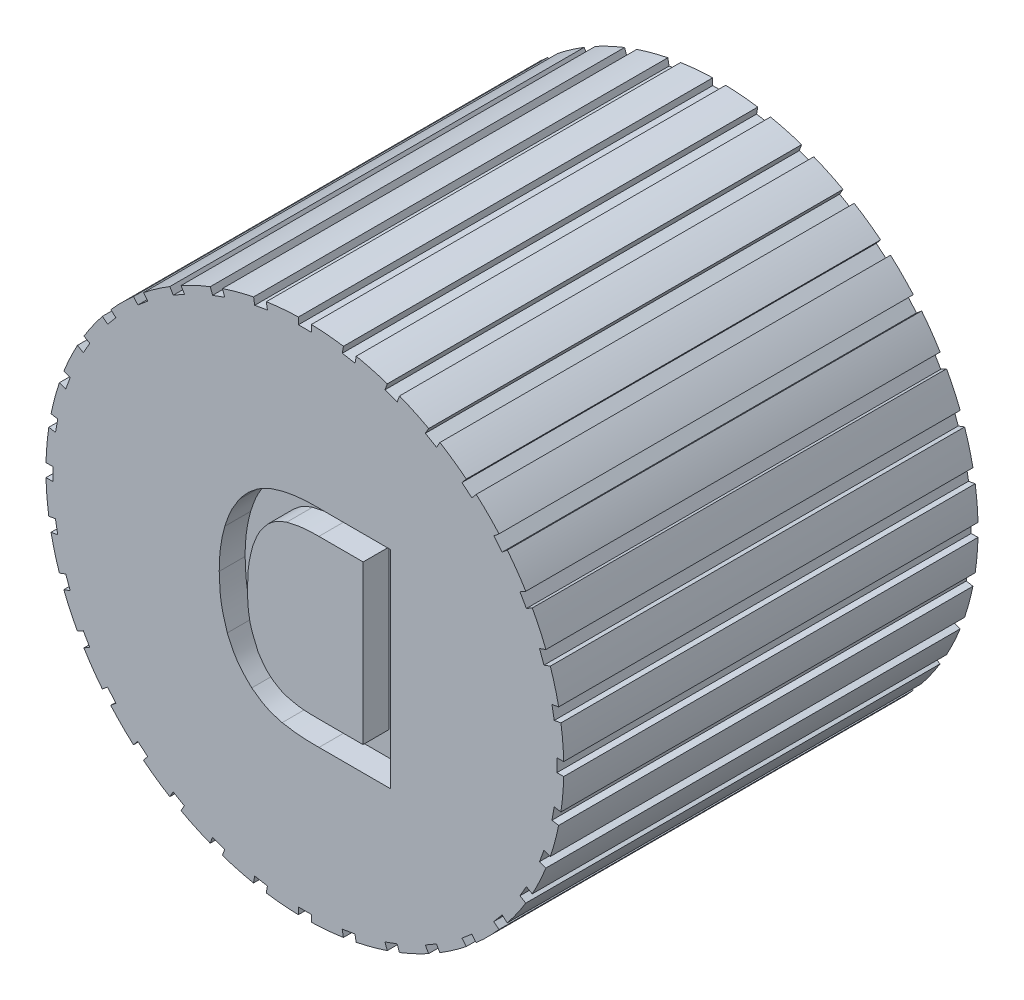
from build123d import *

# Parameters (mm, degrees)
SKETCH1_W                    = 10.000000149
SKETCH1_H                    = 16
CUT_EXTRUDE1_DEPTH           = 16
CUT_EXTRUDE2_DEPTH           = 16
CUT_EXTRUDE3_DEPTH           = 16
CUT_EXTRUDE4_DEPTH           = 16
CUT_EXTRUDE5_DEPTH           = 16
CUT_EXTRUDE6_DEPTH           = 16
CUT_EXTRUDE7_DEPTH           = 16
CUT_EXTRUDE8_DEPTH           = 16
CUT_EXTRUDE9_DEPTH           = 16
CUT_EXTRUDE10_DEPTH          = 16
CUT_EXTRUDE11_DEPTH          = 16
CUT_EXTRUDE12_DEPTH          = 16
CUT_EXTRUDE13_DEPTH          = 16
CUT_EXTRUDE14_DEPTH          = 16
CUT_EXTRUDE15_DEPTH          = 16
CUT_EXTRUDE16_DEPTH          = 16
CUT_EXTRUDE17_DEPTH          = 16
CUT_EXTRUDE18_DEPTH          = 16
CUT_EXTRUDE19_DEPTH          = 16
CUT_EXTRUDE20_DEPTH          = 16
CUT_EXTRUDE21_DEPTH          = 16
CUT_EXTRUDE22_DEPTH          = 16
CUT_EXTRUDE23_DEPTH          = 16
CUT_EXTRUDE24_DEPTH          = 16
CUT_EXTRUDE25_DEPTH          = 16
CUT_EXTRUDE26_DEPTH          = 16
CUT_EXTRUDE27_DEPTH          = 16
CUT_EXTRUDE28_DEPTH          = 16
CUT_EXTRUDE29_DEPTH          = 16
CUT_EXTRUDE30_DEPTH          = 16
CUT_EXTRUDE31_DEPTH          = 16
CUT_EXTRUDE32_DEPTH          = 16
CUT_EXTRUDE33_DEPTH          = 16
CUT_EXTRUDE34_DEPTH          = 16
CUT_EXTRUDE35_DEPTH          = 16
CUT_EXTRUDE36_DEPTH          = 16
CUT_EXTRUDE37_START          = 3
CUT_EXTRUDE37_DEPTH          = 1
BOSS_EXTRUDE1_START          = 3.000001
BOSS_EXTRUDE1_DEPTH          = 1
F_6_0_6_DIAMETER_HOLE1_D     = 6
F_6_0_6_DIAMETER_HOLE1_DEPTH = 14


with BuildPart() as part:
    # Sketch1 → Revolve1 (revolve)
    with BuildSketch(Plane(origin=(0, 0, 0), x_dir=(1, 0, 0), z_dir=(0, 1, 0))):
        with Locations((5.000000074, -8)):
            Rectangle(SKETCH1_W, SKETCH1_H)
    revolve(axis=Axis((0, 0, 0), (0, 0, 1)))

    # Sketch2 → Cut-Extrude1 (cut)
    with BuildSketch(Plane(origin=(0, 0, 0), x_dir=(-1, 0, 0), z_dir=(0, 0, -1))):
        with BuildLine():
            Line((3.182999705, 9.479900625), (3.093633551, 9.234369134))
            Line((3.093633551, 9.234369134), (3.563197034, 9.063462003))
            Line((3.563197034, 9.063462003), (3.65258757, 9.30906048))
            ThreePointArc((3.65258757, 9.30906048), (3.418860912, 9.397414168), (3.182999705, 9.479900625))
        make_face()
    extrude(amount=-CUT_EXTRUDE1_DEPTH, mode=Mode.SUBTRACT)

    # Sketch3 → Cut-Extrude2 (cut)
    with BuildSketch(Plane(origin=(0, 0, 0), x_dir=(-1, 0, 0), z_dir=(0, 0, -1))):
        with BuildLine():
            Line((4.780810256, 8.783157535), (4.650165678, 8.556874488))
            Line((4.650165678, 8.556874488), (5.082917725, 8.307024978))
            Line((5.082917725, 8.307024978), (5.213597945, 8.533369759))
            ThreePointArc((5.213597945, 8.533369759), (4.998764578, 8.660967364), (4.780810256, 8.783157535))
        make_face()
    extrude(amount=-CUT_EXTRUDE2_DEPTH, mode=Mode.SUBTRACT)

    # Sketch4 → Cut-Extrude3 (cut)
    with BuildSketch(Plane(origin=(0, 0, 0), x_dir=(-1, 0, 0), z_dir=(0, 0, -1))):
        with BuildLine():
            Line((6.233358306, 7.819542647), (6.065404874, 7.619383542))
            Line((6.065404874, 7.619383542), (6.448196533, 7.298183202))
            Line((6.448196533, 7.298183202), (6.616195786, 7.498396916))
            ThreePointArc((6.616195786, 7.498396916), (6.426783311, 7.661361449), (6.233358306, 7.819542647))
        make_face()
    extrude(amount=-CUT_EXTRUDE3_DEPTH, mode=Mode.SUBTRACT)

    # Sketch5 → Cut-Extrude4 (cut)
    with BuildSketch(Plane(origin=(0, 0, 0), x_dir=(-1, 0, 0), z_dir=(0, 0, -1))):
        with BuildLine():
            Line((7.496508918, 6.618334914), (7.296349812, 6.450381482))
            Line((7.296349812, 6.450381482), (7.617550152, 6.067589824))
            Line((7.617550152, 6.067589824), (7.817763865, 6.235589077))
            ThreePointArc((7.817763865, 6.235589077), (7.659527486, 6.428968943), (7.496508918, 6.618334914))
        make_face()
    extrude(amount=-CUT_EXTRUDE4_DEPTH, mode=Mode.SUBTRACT)

    # Sketch6 → Cut-Extrude5 (cut)
    with BuildSketch(Plane(origin=(0, 0, 0), x_dir=(-1, 0, 0), z_dir=(0, 0, -1))):
        with BuildLine():
            Line((8.531881899, 5.216032423), (8.305598853, 5.085387845))
            Line((8.305598853, 5.085387845), (8.555448364, 4.652635798))
            Line((8.555448364, 4.652635798), (8.781793145, 4.783316019))
            ThreePointArc((8.781793145, 4.783316019), (8.659540794, 5.001235469), (8.531881899, 5.216032423))
        make_face()
    extrude(amount=-CUT_EXTRUDE5_DEPTH, mode=Mode.SUBTRACT)

    # Sketch7 → Cut-Extrude6 (cut)
    with BuildSketch(Plane(origin=(0, 0, 0), x_dir=(-1, 0, 0), z_dir=(0, 0, -1))):
        with BuildLine():
            Line((9.308017967, 3.655243426), (9.062486476, 3.565877272))
            Line((9.062486476, 3.565877272), (9.233393607, 3.096313789))
            Line((9.233393607, 3.096313789), (9.478992085, 3.185704324))
            ThreePointArc((9.478992085, 3.185704324), (9.396438337, 3.421541987), (9.308017967, 3.655243426))
        make_face()
    extrude(amount=-CUT_EXTRUDE6_DEPTH, mode=Mode.SUBTRACT)

    # Sketch8 → Cut-Extrude7 (cut)
    with BuildSketch(Plane(origin=(0, 0, 0), x_dir=(-1, 0, 0), z_dir=(0, 0, -1))):
        with BuildLine():
            Line((9.801334619, 1.983391707), (9.544015033, 1.938019322))
            Line((9.544015033, 1.938019322), (9.630786858, 1.445911851))
            Line((9.630786858, 1.445911851), (9.888176646, 1.491296615))
            ThreePointArc((9.888176646, 1.491296615), (9.847829855, 1.737886682), (9.801334619, 1.983391707))
        make_face()
    extrude(amount=-CUT_EXTRUDE7_DEPTH, mode=Mode.SUBTRACT)

    # Sketch9 → Cut-Extrude8 (cut)
    with BuildSketch(Plane(origin=(0, 0, 0), x_dir=(-1, 0, 0), z_dir=(0, 0, -1))):
        with BuildLine():
            Line((9.996842678, 0.251275635), (9.735553523, 0.251275635))
            Line((9.735553523, 0.251275635), (9.735553523, -0.248423386))
            Line((9.735553523, -0.248423386), (9.996913964, -0.248423386))
            ThreePointArc((9.996913964, -0.248423386), (10.000000047, 0.00142657), (9.996842678, 0.251275635))
        make_face()
    extrude(amount=-CUT_EXTRUDE8_DEPTH, mode=Mode.SUBTRACT)

    # Sketch10 → Cut-Extrude9 (cut)
    with BuildSketch(Plane(origin=(0, 0, 0), x_dir=(-1, 0, 0), z_dir=(0, 0, -1))):
        with BuildLine():
            Line((9.888601731, -1.48847532), (9.631282146, -1.443102934))
            Line((9.631282146, -1.443102934), (9.544510321, -1.935210405))
            Line((9.544510321, -1.935210405), (9.80190011, -1.980595169))
            ThreePointArc((9.80190011, -1.980595169), (9.848325298, -1.735076888), (9.888601731, -1.48847532))
        make_face()
    extrude(amount=-CUT_EXTRUDE9_DEPTH, mode=Mode.SUBTRACT)

    # Sketch11 → Cut-Extrude10 (cut)
    with BuildSketch(Plane(origin=(0, 0, 0), x_dir=(-1, 0, 0), z_dir=(0, 0, -1))):
        with BuildLine():
            Line((9.479900625, -3.182999705), (9.234369134, -3.093633551))
            Line((9.234369134, -3.093633551), (9.063462003, -3.563197034))
            Line((9.063462003, -3.563197034), (9.30906048, -3.65258757))
            ThreePointArc((9.30906048, -3.65258757), (9.397414168, -3.418860912), (9.479900625, -3.182999705))
        make_face()
    extrude(amount=-CUT_EXTRUDE10_DEPTH, mode=Mode.SUBTRACT)

    # Sketch12 → Cut-Extrude11 (cut)
    with BuildSketch(Plane(origin=(0, 0, 0), x_dir=(-1, 0, 0), z_dir=(0, 0, -1))):
        with BuildLine():
            Line((8.783157535, -4.780810256), (8.556874488, -4.650165678))
            Line((8.556874488, -4.650165678), (8.307024978, -5.082917725))
            Line((8.307024978, -5.082917725), (8.533369759, -5.213597945))
            ThreePointArc((8.533369759, -5.213597945), (8.660967364, -4.998764578), (8.783157535, -4.780810256))
        make_face()
    extrude(amount=-CUT_EXTRUDE11_DEPTH, mode=Mode.SUBTRACT)

    # Sketch13 → Cut-Extrude12 (cut)
    with BuildSketch(Plane(origin=(0, 0, 0), x_dir=(-1, 0, 0), z_dir=(0, 0, -1))):
        with BuildLine():
            Line((7.819542647, -6.233358306), (7.619383542, -6.065404874))
            Line((7.619383542, -6.065404874), (7.298183202, -6.448196533))
            Line((7.298183202, -6.448196533), (7.498396916, -6.616195786))
            ThreePointArc((7.498396916, -6.616195786), (7.661361449, -6.426783311), (7.819542647, -6.233358306))
        make_face()
    extrude(amount=-CUT_EXTRUDE12_DEPTH, mode=Mode.SUBTRACT)

    # Sketch14 → Cut-Extrude13 (cut)
    with BuildSketch(Plane(origin=(0, 0, 0), x_dir=(-1, 0, 0), z_dir=(0, 0, -1))):
        with BuildLine():
            Line((6.618334914, -7.496508918), (6.450381482, -7.296349812))
            Line((6.450381482, -7.296349812), (6.067589824, -7.617550152))
            Line((6.067589824, -7.617550152), (6.235589077, -7.817763865))
            ThreePointArc((6.235589077, -7.817763865), (6.428968943, -7.659527486), (6.618334914, -7.496508918))
        make_face()
    extrude(amount=-CUT_EXTRUDE13_DEPTH, mode=Mode.SUBTRACT)

    # Sketch15 → Cut-Extrude14 (cut)
    with BuildSketch(Plane(origin=(0, 0, 0), x_dir=(-1, 0, 0), z_dir=(0, 0, -1))):
        with BuildLine():
            Line((5.216032423, -8.531881899), (5.085387845, -8.305598853))
            Line((5.085387845, -8.305598853), (4.652635798, -8.555448364))
            Line((4.652635798, -8.555448364), (4.783316019, -8.781793145))
            ThreePointArc((4.783316019, -8.781793145), (5.001235469, -8.659540794), (5.216032423, -8.531881899))
        make_face()
    extrude(amount=-CUT_EXTRUDE14_DEPTH, mode=Mode.SUBTRACT)

    # Sketch16 → Cut-Extrude15 (cut)
    with BuildSketch(Plane(origin=(0, 0, 0), x_dir=(-1, 0, 0), z_dir=(0, 0, -1))):
        with BuildLine():
            Line((3.655243426, -9.308017967), (3.565877272, -9.062486476))
            Line((3.565877272, -9.062486476), (3.096313789, -9.233393607))
            Line((3.096313789, -9.233393607), (3.185704324, -9.478992085))
            ThreePointArc((3.185704324, -9.478992085), (3.421541987, -9.396438337), (3.655243426, -9.308017967))
        make_face()
    extrude(amount=-CUT_EXTRUDE15_DEPTH, mode=Mode.SUBTRACT)

    # Sketch17 → Cut-Extrude16 (cut)
    with BuildSketch(Plane(origin=(0, 0, 0), x_dir=(-1, 0, 0), z_dir=(0, 0, -1))):
        with BuildLine():
            Line((1.983391707, -9.801334619), (1.938019322, -9.544015033))
            Line((1.938019322, -9.544015033), (1.445911851, -9.630786858))
            Line((1.445911851, -9.630786858), (1.491296615, -9.888176646))
            ThreePointArc((1.491296615, -9.888176646), (1.737886682, -9.847829855), (1.983391707, -9.801334619))
        make_face()
    extrude(amount=-CUT_EXTRUDE16_DEPTH, mode=Mode.SUBTRACT)

    # Sketch18 → Cut-Extrude17 (cut)
    with BuildSketch(Plane(origin=(0, 0, 0), x_dir=(-1, 0, 0), z_dir=(0, 0, -1))):
        with BuildLine():
            Line((0.251275635, -9.996842678), (0.251275635, -9.735553523))
            Line((0.251275635, -9.735553523), (-0.248423386, -9.735553523))
            Line((-0.248423386, -9.735553523), (-0.248423386, -9.996913964))
            ThreePointArc((-0.248423386, -9.996913964), (0.00142657, -10.000000047), (0.251275635, -9.996842678))
        make_face()
    extrude(amount=-CUT_EXTRUDE17_DEPTH, mode=Mode.SUBTRACT)

    # Sketch19 → Cut-Extrude18 (cut)
    with BuildSketch(Plane(origin=(0, 0, 0), x_dir=(-1, 0, 0), z_dir=(0, 0, -1))):
        with BuildLine():
            Line((-1.48847532, -9.888601731), (-1.443102934, -9.631282146))
            Line((-1.443102934, -9.631282146), (-1.935210405, -9.544510321))
            Line((-1.935210405, -9.544510321), (-1.980595169, -9.80190011))
            ThreePointArc((-1.980595169, -9.80190011), (-1.735076888, -9.848325298), (-1.48847532, -9.888601731))
        make_face()
    extrude(amount=-CUT_EXTRUDE18_DEPTH, mode=Mode.SUBTRACT)

    # Sketch20 → Cut-Extrude19 (cut)
    with BuildSketch(Plane(origin=(0, 0, 0), x_dir=(-1, 0, 0), z_dir=(0, 0, -1))):
        with BuildLine():
            Line((-3.182999705, -9.479900625), (-3.093633551, -9.234369134))
            Line((-3.093633551, -9.234369134), (-3.563197034, -9.063462003))
            Line((-3.563197034, -9.063462003), (-3.65258757, -9.30906048))
            ThreePointArc((-3.65258757, -9.30906048), (-3.418860912, -9.397414168), (-3.182999705, -9.479900625))
        make_face()
    extrude(amount=-CUT_EXTRUDE19_DEPTH, mode=Mode.SUBTRACT)

    # Sketch21 → Cut-Extrude20 (cut)
    with BuildSketch(Plane(origin=(0, 0, 0), x_dir=(-1, 0, 0), z_dir=(0, 0, -1))):
        with BuildLine():
            Line((-4.780810256, -8.783157535), (-4.650165678, -8.556874488))
            Line((-4.650165678, -8.556874488), (-5.082917725, -8.307024978))
            Line((-5.082917725, -8.307024978), (-5.213597945, -8.533369759))
            ThreePointArc((-5.213597945, -8.533369759), (-4.998764578, -8.660967364), (-4.780810256, -8.783157535))
        make_face()
    extrude(amount=-CUT_EXTRUDE20_DEPTH, mode=Mode.SUBTRACT)

    # Sketch22 → Cut-Extrude21 (cut)
    with BuildSketch(Plane(origin=(0, 0, 0), x_dir=(-1, 0, 0), z_dir=(0, 0, -1))):
        with BuildLine():
            Line((-6.233358306, -7.819542647), (-6.065404874, -7.619383542))
            Line((-6.065404874, -7.619383542), (-6.448196533, -7.298183202))
            Line((-6.448196533, -7.298183202), (-6.616195786, -7.498396916))
            ThreePointArc((-6.616195786, -7.498396916), (-6.426783311, -7.661361449), (-6.233358306, -7.819542647))
        make_face()
    extrude(amount=-CUT_EXTRUDE21_DEPTH, mode=Mode.SUBTRACT)

    # Sketch23 → Cut-Extrude22 (cut)
    with BuildSketch(Plane(origin=(0, 0, 0), x_dir=(-1, 0, 0), z_dir=(0, 0, -1))):
        with BuildLine():
            Line((-7.496508918, -6.618334914), (-7.296349812, -6.450381482))
            Line((-7.296349812, -6.450381482), (-7.617550152, -6.067589824))
            Line((-7.617550152, -6.067589824), (-7.817763865, -6.235589077))
            ThreePointArc((-7.817763865, -6.235589077), (-7.659527486, -6.428968943), (-7.496508918, -6.618334914))
        make_face()
    extrude(amount=-CUT_EXTRUDE22_DEPTH, mode=Mode.SUBTRACT)

    # Sketch24 → Cut-Extrude23 (cut)
    with BuildSketch(Plane(origin=(0, 0, 0), x_dir=(-1, 0, 0), z_dir=(0, 0, -1))):
        with BuildLine():
            Line((-8.531881899, -5.216032423), (-8.305598853, -5.085387845))
            Line((-8.305598853, -5.085387845), (-8.555448364, -4.652635798))
            Line((-8.555448364, -4.652635798), (-8.781793145, -4.783316019))
            ThreePointArc((-8.781793145, -4.783316019), (-8.659540794, -5.001235469), (-8.531881899, -5.216032423))
        make_face()
    extrude(amount=-CUT_EXTRUDE23_DEPTH, mode=Mode.SUBTRACT)

    # Sketch25 → Cut-Extrude24 (cut)
    with BuildSketch(Plane(origin=(0, 0, 0), x_dir=(-1, 0, 0), z_dir=(0, 0, -1))):
        with BuildLine():
            Line((-9.308017967, -3.655243426), (-9.062486476, -3.565877272))
            Line((-9.062486476, -3.565877272), (-9.233393607, -3.096313789))
            Line((-9.233393607, -3.096313789), (-9.478992085, -3.185704324))
            ThreePointArc((-9.478992085, -3.185704324), (-9.396438337, -3.421541987), (-9.308017967, -3.655243426))
        make_face()
    extrude(amount=-CUT_EXTRUDE24_DEPTH, mode=Mode.SUBTRACT)

    # Sketch26 → Cut-Extrude25 (cut)
    with BuildSketch(Plane(origin=(0, 0, 0), x_dir=(-1, 0, 0), z_dir=(0, 0, -1))):
        with BuildLine():
            Line((-9.801334619, -1.983391707), (-9.544015033, -1.938019322))
            Line((-9.544015033, -1.938019322), (-9.630786858, -1.445911851))
            Line((-9.630786858, -1.445911851), (-9.888176646, -1.491296615))
            ThreePointArc((-9.888176646, -1.491296615), (-9.847829855, -1.737886682), (-9.801334619, -1.983391707))
        make_face()
    extrude(amount=-CUT_EXTRUDE25_DEPTH, mode=Mode.SUBTRACT)

    # Sketch27 → Cut-Extrude26 (cut)
    with BuildSketch(Plane(origin=(0, 0, 0), x_dir=(-1, 0, 0), z_dir=(0, 0, -1))):
        with BuildLine():
            Line((-9.996842678, -0.251275635), (-9.735553523, -0.251275635))
            Line((-9.735553523, -0.251275635), (-9.735553523, 0.248423386))
            Line((-9.735553523, 0.248423386), (-9.996913964, 0.248423386))
            ThreePointArc((-9.996913964, 0.248423386), (-10.000000047, -0.00142657), (-9.996842678, -0.251275635))
        make_face()
    extrude(amount=-CUT_EXTRUDE26_DEPTH, mode=Mode.SUBTRACT)

    # Sketch28 → Cut-Extrude27 (cut)
    with BuildSketch(Plane(origin=(0, 0, 0), x_dir=(-1, 0, 0), z_dir=(0, 0, -1))):
        with BuildLine():
            Line((-9.888601731, 1.48847532), (-9.631282146, 1.443102934))
            Line((-9.631282146, 1.443102934), (-9.544510321, 1.935210405))
            Line((-9.544510321, 1.935210405), (-9.80190011, 1.980595169))
            ThreePointArc((-9.80190011, 1.980595169), (-9.848325298, 1.735076888), (-9.888601731, 1.48847532))
        make_face()
    extrude(amount=-CUT_EXTRUDE27_DEPTH, mode=Mode.SUBTRACT)

    # Sketch29 → Cut-Extrude28 (cut)
    with BuildSketch(Plane(origin=(0, 0, 0), x_dir=(-1, 0, 0), z_dir=(0, 0, -1))):
        with BuildLine():
            Line((-9.479900625, 3.182999705), (-9.234369134, 3.093633551))
            Line((-9.234369134, 3.093633551), (-9.063462003, 3.563197034))
            Line((-9.063462003, 3.563197034), (-9.30906048, 3.65258757))
            ThreePointArc((-9.30906048, 3.65258757), (-9.397414168, 3.418860912), (-9.479900625, 3.182999705))
        make_face()
    extrude(amount=-CUT_EXTRUDE28_DEPTH, mode=Mode.SUBTRACT)

    # Sketch30 → Cut-Extrude29 (cut)
    with BuildSketch(Plane(origin=(0, 0, 0), x_dir=(-1, 0, 0), z_dir=(0, 0, -1))):
        with BuildLine():
            Line((-8.783157535, 4.780810256), (-8.556874488, 4.650165678))
            Line((-8.556874488, 4.650165678), (-8.307024978, 5.082917725))
            Line((-8.307024978, 5.082917725), (-8.533369759, 5.213597945))
            ThreePointArc((-8.533369759, 5.213597945), (-8.660967364, 4.998764578), (-8.783157535, 4.780810256))
        make_face()
    extrude(amount=-CUT_EXTRUDE29_DEPTH, mode=Mode.SUBTRACT)

    # Sketch31 → Cut-Extrude30 (cut)
    with BuildSketch(Plane(origin=(0, 0, 0), x_dir=(-1, 0, 0), z_dir=(0, 0, -1))):
        with BuildLine():
            Line((-7.819542647, 6.233358306), (-7.619383542, 6.065404874))
            Line((-7.619383542, 6.065404874), (-7.298183202, 6.448196533))
            Line((-7.298183202, 6.448196533), (-7.498396916, 6.616195786))
            ThreePointArc((-7.498396916, 6.616195786), (-7.661361449, 6.426783311), (-7.819542647, 6.233358306))
        make_face()
    extrude(amount=-CUT_EXTRUDE30_DEPTH, mode=Mode.SUBTRACT)

    # Sketch32 → Cut-Extrude31 (cut)
    with BuildSketch(Plane(origin=(0, 0, 0), x_dir=(-1, 0, 0), z_dir=(0, 0, -1))):
        with BuildLine():
            Line((-6.618334914, 7.496508918), (-6.450381482, 7.296349812))
            Line((-6.450381482, 7.296349812), (-6.067589824, 7.617550152))
            Line((-6.067589824, 7.617550152), (-6.235589077, 7.817763865))
            ThreePointArc((-6.235589077, 7.817763865), (-6.428968943, 7.659527486), (-6.618334914, 7.496508918))
        make_face()
    extrude(amount=-CUT_EXTRUDE31_DEPTH, mode=Mode.SUBTRACT)

    # Sketch33 → Cut-Extrude32 (cut)
    with BuildSketch(Plane(origin=(0, 0, 0), x_dir=(-1, 0, 0), z_dir=(0, 0, -1))):
        with BuildLine():
            Line((-5.216032423, 8.531881899), (-5.085387845, 8.305598853))
            Line((-5.085387845, 8.305598853), (-4.652635798, 8.555448364))
            Line((-4.652635798, 8.555448364), (-4.783316019, 8.781793145))
            ThreePointArc((-4.783316019, 8.781793145), (-5.001235469, 8.659540794), (-5.216032423, 8.531881899))
        make_face()
    extrude(amount=-CUT_EXTRUDE32_DEPTH, mode=Mode.SUBTRACT)

    # Sketch34 → Cut-Extrude33 (cut)
    with BuildSketch(Plane(origin=(0, 0, 0), x_dir=(-1, 0, 0), z_dir=(0, 0, -1))):
        with BuildLine():
            Line((-3.655243426, 9.308017967), (-3.565877272, 9.062486476))
            Line((-3.565877272, 9.062486476), (-3.096313789, 9.233393607))
            Line((-3.096313789, 9.233393607), (-3.185704324, 9.478992085))
            ThreePointArc((-3.185704324, 9.478992085), (-3.421541987, 9.396438337), (-3.655243426, 9.308017967))
        make_face()
    extrude(amount=-CUT_EXTRUDE33_DEPTH, mode=Mode.SUBTRACT)

    # Sketch35 → Cut-Extrude34 (cut)
    with BuildSketch(Plane(origin=(0, 0, 0), x_dir=(-1, 0, 0), z_dir=(0, 0, -1))):
        with BuildLine():
            Line((-1.983391707, 9.801334619), (-1.938019322, 9.544015033))
            Line((-1.938019322, 9.544015033), (-1.445911851, 9.630786858))
            Line((-1.445911851, 9.630786858), (-1.491296615, 9.888176646))
            ThreePointArc((-1.491296615, 9.888176646), (-1.737886682, 9.847829855), (-1.983391707, 9.801334619))
        make_face()
    extrude(amount=-CUT_EXTRUDE34_DEPTH, mode=Mode.SUBTRACT)

    # Sketch36 → Cut-Extrude35 (cut)
    with BuildSketch(Plane(origin=(0, 0, 0), x_dir=(-1, 0, 0), z_dir=(0, 0, -1))):
        with BuildLine():
            Line((-0.251275635, 9.996842678), (-0.251275635, 9.735553523))
            Line((-0.251275635, 9.735553523), (0.248423386, 9.735553523))
            Line((0.248423386, 9.735553523), (0.248423386, 9.996913964))
            ThreePointArc((0.248423386, 9.996913964), (-0.00142657, 10.000000047), (-0.251275635, 9.996842678))
        make_face()
    extrude(amount=-CUT_EXTRUDE35_DEPTH, mode=Mode.SUBTRACT)

    # Sketch37 → Cut-Extrude36 (cut)
    with BuildSketch(Plane(origin=(0, 0, 0), x_dir=(-1, 0, 0), z_dir=(0, 0, -1))):
        with BuildLine():
            Line((1.48847532, 9.888601731), (1.443102934, 9.631282146))
            Line((1.443102934, 9.631282146), (1.935210405, 9.544510321))
            Line((1.935210405, 9.544510321), (1.980595169, 9.80190011))
            ThreePointArc((1.980595169, 9.80190011), (1.735076888, 9.848325298), (1.48847532, 9.888601731))
        make_face()
    extrude(amount=-CUT_EXTRUDE36_DEPTH, mode=Mode.SUBTRACT)

    # Sketch38 → Cut-Extrude37 (cut)
    with BuildSketch(Plane.XY.offset(13).offset(CUT_EXTRUDE37_START)):
        with BuildLine():
            Line((3.3033669, -4.002966267), (0.54756961, -4.00049336))
            ThreePointArc((0.54756961, -4.00049336), (-0.167609212, -3.980519055), (-0.876610368, -3.884617652))
            add(Edge.make_bspline(
                [(-0.876610368, -3.884617652), (-0.923487918, -3.871375024), (-1.01720676, -3.844900011), (-1.157067659, -3.802861467), (-1.295408676, -3.756020552), (-1.431390073, -3.7020168), (-1.563276128, -3.638123822), (-1.689894175, -3.564078365), (-1.812232624, -3.483260059), (-1.93156228, -3.397973581), (-2.010090581, -3.339709968), (-2.049355939, -3.310577266)],
                knots=[0, 0, 0, 0, 0.110942713, 0.221799617, 0.332579393, 0.443492943, 0.554812983, 0.665987024, 0.777299481, 0.888646317, 1, 1, 1, 1], degree=3))
            add(Edge.make_bspline(
                [(-2.049355939, -3.310577266), (-2.129739457, -3.232269896), (-2.290286685, -3.075869287), (-2.517041315, -2.827255504), (-2.707677207, -2.549735537), (-2.859983685, -2.250193383), (-2.94991448, -2.04529319), (-2.994923646, -1.942743369)],
                knots=[0, 0, 0, 0, 0.200524281, 0.400500227, 0.600167554, 0.799889179, 1, 1, 1, 1], degree=3))
            add(Edge.make_bspline(
                [(-2.994923646, -1.942743369), (-3.016083615, -1.874286512), (-3.058392634, -1.737408118), (-3.119019049, -1.531272616), (-3.173873081, -1.323519452), (-3.220199914, -1.113433216), (-3.254216601, -0.900766571), (-3.276957667, -0.686458325), (-3.291531412, -0.471457024), (-3.300595739, -0.256121471), (-3.304862616, -0.112500744), (-3.306996086, -0.040689352)],
                knots=[0, 0, 0, 0, 0.110984201, 0.221911142, 0.332787091, 0.443747327, 0.554989245, 0.666185241, 0.777444526, 0.888720669, 1, 1, 1, 1], degree=3))
            ThreePointArc((-3.306996086, -0.040689352), (-3.259024092, 0.774704193), (-3.09272236, 1.574398934))
            add(Edge.make_bspline(
                [(-3.09272236, 1.574398934), (-3.077730684, 1.619896957), (-3.047747681, 1.710891942), (-3.001246337, 1.846871926), (-2.951651106, 1.981736301), (-2.897493877, 2.114841808), (-2.837120229, 2.245156365), (-2.769837264, 2.371887774), (-2.697869014, 2.495844176), (-2.622720629, 2.617894955), (-2.571559995, 2.698614993), (-2.54597393, 2.738984082)],
                knots=[0, 0, 0, 0, 0.111255856, 0.222509113, 0.333749071, 0.444937985, 0.556160789, 0.667140911, 0.778048319, 0.888999222, 1, 1, 1, 1], degree=3))
            add(Edge.make_bspline(
                [(-2.54597393, 2.738984082), (-2.522572488, 2.769332857), (-2.475770259, 2.830029559), (-2.404455146, 2.92020651), (-2.330893987, 3.008539286), (-2.254061282, 3.094054025), (-2.172911397, 3.175379289), (-2.087315346, 3.251826743), (-1.998784094, 3.324642759), (-1.908277982, 3.3949827), (-1.847304388, 3.44106662), (-1.816809941, 3.464114362)],
                knots=[0, 0, 0, 0, 0.111274718, 0.222546321, 0.333801473, 0.444994883, 0.556233557, 0.667198037, 0.778080169, 0.889012242, 1, 1, 1, 1], degree=3))
            add(Edge.make_bspline(
                [(-1.816809941, 3.464114362), (-1.783521974, 3.483617227), (-1.716947145, 3.522622308), (-1.616306464, 3.579782102), (-1.514162379, 3.634165045), (-1.40989483, 3.68441385), (-1.302988572, 3.728627782), (-1.194055622, 3.767300003), (-1.083871012, 3.801914594), (-0.972868849, 3.833792635), (-0.898608795, 3.854162073), (-0.861471345, 3.864348829)],
                knots=[0, 0, 0, 0, 0.111233889, 0.222464087, 0.333675653, 0.444815802, 0.556032944, 0.667043337, 0.777987292, 0.888971455, 1, 1, 1, 1], degree=3))
            ThreePointArc((-0.861471345, 3.864348829), (-0.222867828, 3.970201975), (0.423780344, 3.999621062))
            Line((0.423780344, 3.999621062), (3.310545675, 3.997030631))
            Line((3.310545675, 3.997030631), (3.3033669, -4.002966267))
        make_face()
    extrude(amount=-CUT_EXTRUDE37_DEPTH, mode=Mode.SUBTRACT)

    # Sketch39 → Boss-Extrude1 (add)
    with BuildSketch(Plane.YX.offset(-18.0000007).offset(BOSS_EXTRUDE1_START)):
        with BuildLine():
            Line((-3.056442979, 0.564787769), (-3.057951208, 2.245551648))
            Line((-3.057951208, 2.245551648), (3.053914951, 2.251036115))
            Line((3.053914951, 2.251036115), (3.055447664, 0.542987624))
            add(Edge.make_bspline(
                [(3.055447664, 0.542987624), (3.055036856, 0.496473269), (3.054215246, 0.40344537), (3.051623706, 0.263922272), (3.046266176, 0.124489415), (3.036787318, -0.014722248), (3.02165876, -0.15335817), (2.999415637, -0.290906979), (2.972233078, -0.427424997), (2.941641852, -0.563219009), (2.920030636, -0.653478145), (2.90922265, -0.698617646)],
                knots=[0, 0, 0, 0, 0.111246991, 0.222492041, 0.333727064, 0.444924098, 0.556135914, 0.667120295, 0.778037201, 0.888994176, 1, 1, 1, 1], degree=3))
            add(Edge.make_bspline(
                [(2.90922265, -0.698617646), (2.89855849, -0.727758856), (2.877230676, -0.786039898), (2.843880985, -0.87295222), (2.807687287, -0.958694471), (2.767307844, -1.042558764), (2.72136097, -1.123388105), (2.66942762, -1.20029774), (2.613533936, -1.274134879), (2.554982504, -1.345875081), (2.515088586, -1.393010334), (2.495132865, -1.416588313)],
                knots=[0, 0, 0, 0, 0.111400037, 0.222794802, 0.3341611, 0.445419616, 0.556755955, 0.667609069, 0.778315679, 0.889109149, 1, 1, 1, 1], degree=3))
            add(Edge.make_bspline(
                [(2.495132865, -1.416588313), (2.461776316, -1.444922379), (2.395065258, -1.501588778), (2.293483493, -1.584774298), (2.188966875, -1.664166144), (2.08026948, -1.737830158), (1.966308877, -1.802851241), (1.848385039, -1.859961421), (1.728023322, -1.911248396), (1.606083123, -1.958628541), (1.524290825, -1.988957535), (1.483380889, -2.004127144)],
                knots=[0, 0, 0, 0, 0.111317104, 0.222627397, 0.333904368, 0.445047542, 0.556341876, 0.667290761, 0.778123862, 0.889024531, 1, 1, 1, 1], degree=3))
            add(Edge.make_bspline(
                [(1.483380889, -2.004127144), (1.427402255, -2.018859358), (1.315446624, -2.048323356), (1.146960867, -2.09037149), (0.977499643, -2.128171755), (0.806729273, -2.159727305), (0.634600913, -2.182282058), (0.46174313, -2.197114242), (0.288609918, -2.206382372), (0.115322995, -2.211912805), (-0.000246218, -2.21437485), (-0.058039726, -2.215606062)],
                knots=[0, 0, 0, 0, 0.111202528, 0.222401802, 0.333586024, 0.44470972, 0.555902878, 0.666941668, 0.777929351, 0.888947571, 1, 1, 1, 1], degree=3))
            add(Edge.make_bspline(
                [(-0.058039726, -2.215606062), (-0.190697926, -2.213237234), (-0.45585324, -2.208502453), (-0.853409127, -2.179984182), (-1.245889002, -2.103198537), (-1.62210772, -1.966914774), (-1.865560634, -1.859245253), (-1.987467094, -1.805330884)],
                knots=[0, 0, 0, 0, 0.199710008, 0.399177509, 0.599269845, 0.799338632, 1, 1, 1, 1], degree=3))
            add(Edge.make_bspline(
                [(-1.987467094, -1.805330884), (-2.029633874, -1.776768236), (-2.113963547, -1.719645572), (-2.238554153, -1.631343474), (-2.358673265, -1.537805132), (-2.471699569, -1.436747402), (-2.574413422, -1.325511013), (-2.664733276, -1.203359712), (-2.745772401, -1.074062506), (-2.820286977, -0.940325966), (-2.867762395, -0.849963673), (-2.891502628, -0.804777722)],
                knots=[0, 0, 0, 0, 0.111480143, 0.222950015, 0.334207577, 0.444556565, 0.554462383, 0.664972322, 0.776569307, 0.888272776, 1, 1, 1, 1], degree=3))
            add(Edge.make_bspline(
                [(-2.891502628, -0.804777722), (-2.904292481, -0.755060597), (-2.929871631, -0.65562851), (-2.965773246, -0.505862711), (-2.99734663, -0.355157646), (-3.022704308, -0.203234107), (-3.0391615, -0.050139088), (-3.049075369, 0.103436773), (-3.054189524, 0.257164684), (-3.056102807, 0.410959165), (-3.056329578, 0.513506667), (-3.056442979, 0.564787769)],
                knots=[0, 0, 0, 0, 0.111188596, 0.222372349, 0.333539891, 0.444631851, 0.555822245, 0.66688044, 0.777890718, 0.888929437, 1, 1, 1, 1], degree=3))
        make_face()
    extrude(amount=-BOSS_EXTRUDE1_DEPTH)

    # Ø6.0 (6) Diameter Hole1
    with Locations(Plane(origin=(0, 0, 0), x_dir=(-1, 0, 0), z_dir=(0, 0, -1))):
        with Locations((0, 0)):
            Hole(F_6_0_6_DIAMETER_HOLE1_D / 2, depth=F_6_0_6_DIAMETER_HOLE1_DEPTH)


solid = part.part
